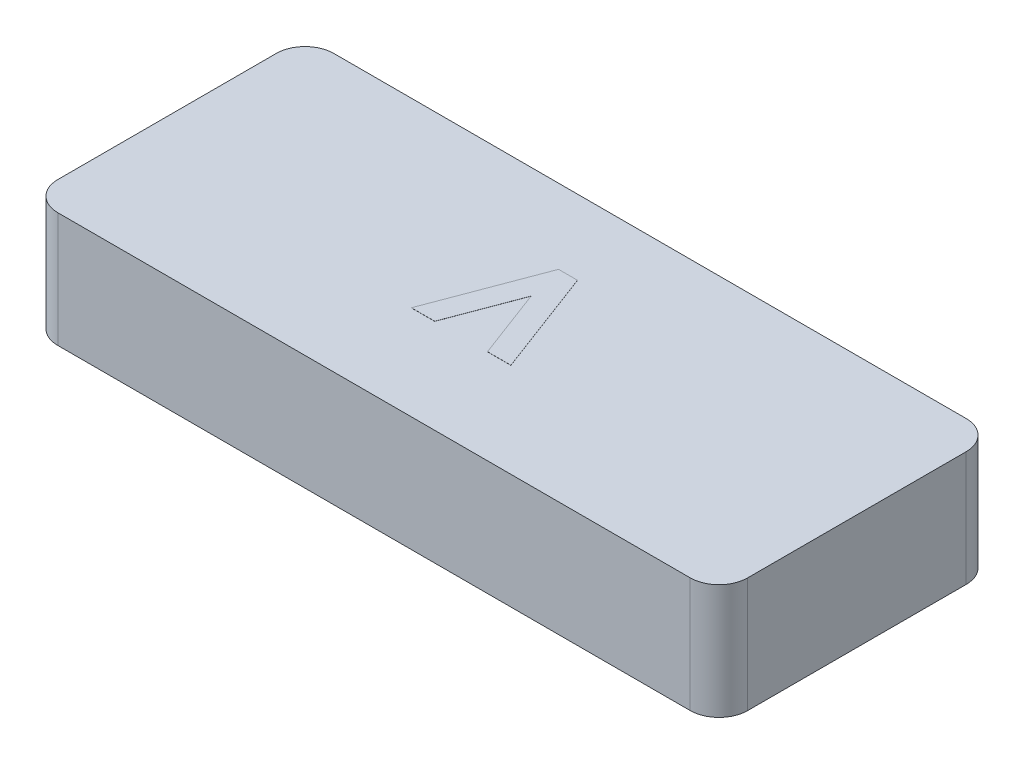
from build123d import *

# Parameters (mm, degrees)
SKETCH1_W           = 15.24
SKETCH1_H           = 6.096
BOSS_EXTRUDE1_DEPTH = 2.54
SHELL1_T            = -0.635
FILLET1_R           = 0.635
SKETCH2_R           = 1.5875
BOSS_EXTRUDE2_DEPTH = 1.905
BOSS_EXTRUDE3_DEPTH = 0.00254


with BuildPart() as part:
    # Sketch1 → Boss-Extrude1 (new body)
    with BuildSketch(Plane(origin=(0, 0, 0), x_dir=(1, 0, 0), z_dir=(0, 1, 0))):
        with Locations((7.62, 3.048)):
            Rectangle(SKETCH1_W, SKETCH1_H)
    extrude(amount=BOSS_EXTRUDE1_DEPTH)

    # Shell1
    shell1_openings = [part.faces().sort_by_distance(p)[0] for p in [
        (7.62, 0, -3.048),
    ]]
    offset(amount=SHELL1_T, openings=shell1_openings, kind=Kind.INTERSECTION)

    # Fillet1
    fillet1_edges = [part.edges().sort_by_distance(p)[0] for p in [
        (0, 1.27, 0),
        (15.24, 1.27, 0),
        (15.24, 1.27, -6.096),
        (0, 1.27, -6.096),
    ]]
    fillet(fillet1_edges, radius=FILLET1_R)

    # Sketch2 → Boss-Extrude2 (add)
    with BuildSketch(Plane.XZ.offset(-1.905)):
        with Locations(Location((7.62, -3.048, 0), (0, 0, 270))):
            Circle(SKETCH2_R)
    extrude(amount=BOSS_EXTRUDE2_DEPTH)

    # Sketch3 → Boss-Extrude3 (add)
    with BuildSketch(Plane(origin=(0, 2.54, 0), x_dir=(1, 0, 0), z_dir=(0, 1, 0))):
        Polygon((7.251008013, 4.445), (7.669507612, 4.445), (8.558660256, 2.084102564), (8.042213942, 2.084102564), (7.459621795, 3.630897436), (6.87639363, 2.084102564), (6.360583333, 2.084102564), align=None)
    extrude(amount=BOSS_EXTRUDE3_DEPTH)


solid = part.part
